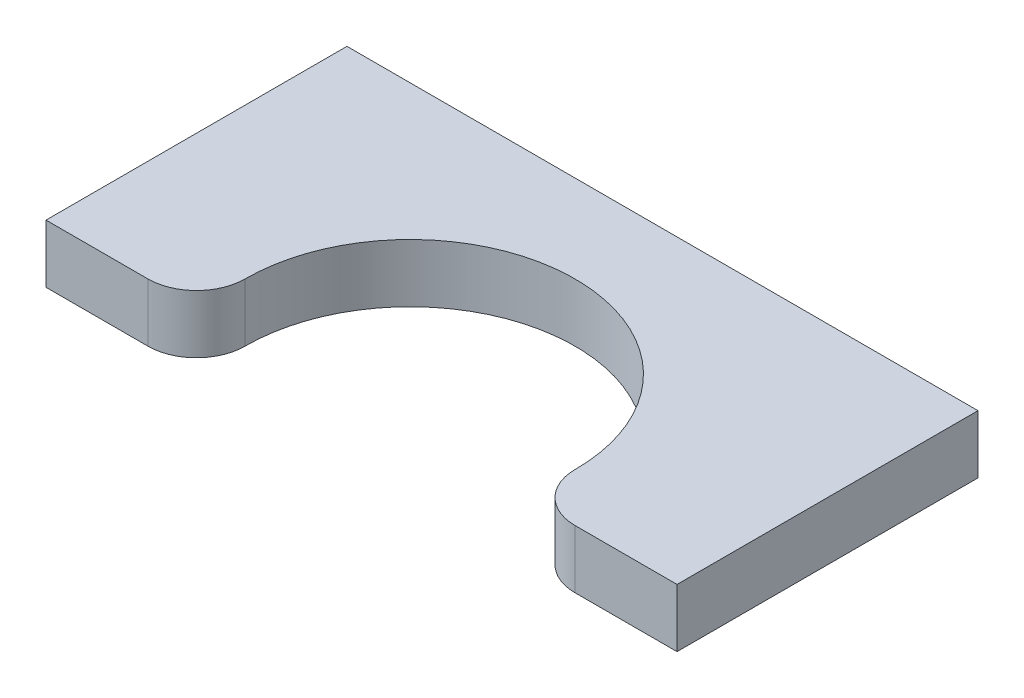
from build123d import *

# Parameters (mm, degrees)
BOSS_EXTRUDE1_DEPTH      = 3
BOSS_EXTRUDE1_DEPTH_BACK = 3
FILLET1_R                = 5


with BuildPart() as part:
    # Sketch1 → Boss-Extrude1 (new, two sides: drawn at the far end of the back side and taken through both)
    with BuildSketch(Plane(origin=(0, 0, 0), x_dir=(1, 0, 0), z_dir=(0, 1, 0)).offset(-BOSS_EXTRUDE1_DEPTH_BACK)):
        with BuildLine():
            Line((16.248076809, -15.5), (32.5, -15.5))
            Line((32.5, -15.5), (32.5, 15.5))
            Line((32.5, 15.5), (-32.5, 15.5))
            Line((-32.5, 15.5), (-32.5, -15.5))
            Line((-32.5, -15.5), (-16.248076809, -15.5))
            ThreePointArc((-16.248076809, -15.5), (0, 6.5), (16.248076809, -15.5))
        make_face()
    extrude(amount=BOSS_EXTRUDE1_DEPTH + BOSS_EXTRUDE1_DEPTH_BACK)

    # Fillet1
    fillet1_edges = [part.edges().sort_by_distance(p)[0] for p in [
        (16.248076809, 0, 15.5),
        (-16.248076809, 0, 15.5),
    ]]
    fillet(fillet1_edges, radius=FILLET1_R)


solid = part.part
